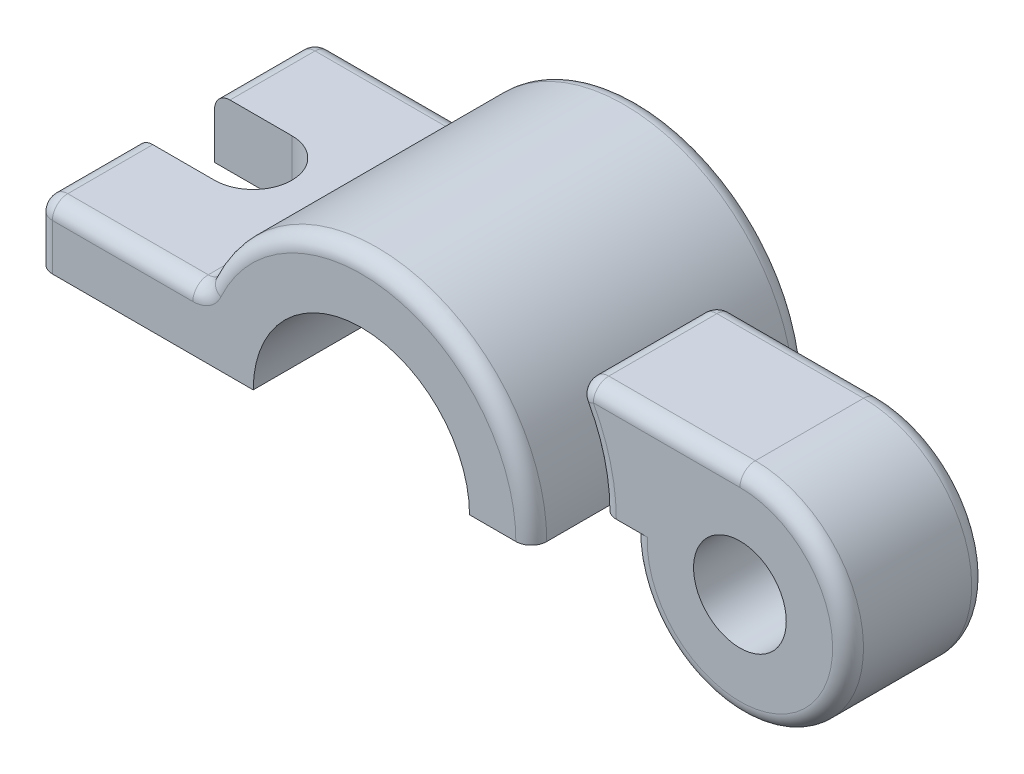
from build123d import *

# Parameters (mm, degrees)
EXTRUDE_1_DEPTH     = 18
SKETCH_4_R          = 6
EXTRUDE_4_DEPTH     = 36
CUT_EXTRUDE_START   = -28
SKETCH_7_W          = 36.681614088
SKETCH_7_H          = 9
CUT_EXTRUDE_5_DEPTH = 28
FILLET_1_R          = 2
CUT_EXTRUDE_6_DEPTH = 62.181883925
FILLET_2_R          = 2


with BuildPart() as part:
    # 草圖1 → 填料-伸長1 (new, symmetric)
    with BuildSketch(Plane.XY):
        with BuildLine():
            Line((14, 0), (22, 0))
            ThreePointArc((22, 0), (4.070268191, 21.620196966), (-20.493901532, 8))
            Line((-20.493901532, 8), (-42, 8))
            Line((-42, 8), (-42, 0))
            Line((-42, 0), (-14, 0))
            ThreePointArc((-14, 0), (0, 14), (14, 0))
        make_face()
    extrude(amount=EXTRUDE_1_DEPTH, both=True)

    # 圓角1
    fillet_1_edges = [part.edges().sort_by_distance(p)[0] for p in [
        (-20.493901532, 8, 0),
        (-42, 8, 0),
        (4.070268191, 21.620196966, 18),
        (-31.246950766, 8, 18),
        (4.070268191, 21.620196966, -18),
        (-42, 4, 18),
        (-42, 4, -18),
        (-31.246950766, 8, -18),
    ]]
    fillet(fillet_1_edges, radius=FILLET_1_R)

    # 草圖2 → 除料-伸長6 (cut, through all)
    with BuildSketch(Plane(origin=(0, 8, 0), x_dir=(1, 0, 0), z_dir=(0, 1, 0))):
        with BuildLine():
            Line((-42, -5), (-42, 5))
            Line((-42, 5), (-32, 5))
            ThreePointArc((-32, 5), (-27, 0), (-32, -5))
            Line((-32, -5), (-42, -5))
        make_face()
    extrude(amount=-CUT_EXTRUDE_6_DEPTH, mode=Mode.SUBTRACT)


with BuildPart() as body_2:
    # 草圖4 → 填料-伸長4 (new body)
    with BuildSketch(Plane.XY.offset(18)):
        with BuildLine():
            Line((40, 13.567369288), (17.318385912, 13.567369288))
            ThreePointArc((17.318385912, 13.567369288), (20.796688319, 7.176193627), (22, 0))
            Line((22, 0), (26.006686216, 0))
            ThreePointArc((26.006686216, 0), (49.745336578, -10.483919932), (40, 13.567369288))
        make_face()
        with Locations((40, -0.432630712)):
            Circle(SKETCH_4_R, mode=Mode.SUBTRACT)
    extrude(amount=-EXTRUDE_4_DEPTH)

    # 草圖7 → 除料-伸長5 (cut)
    with BuildSketch(Plane(origin=(0, 13.567369288, 0), x_dir=(1, 0, 0), z_dir=(0, 1, 0)).offset(CUT_EXTRUDE_START)):
        with Locations((35.659192956, 13.5)):
            Rectangle(SKETCH_7_W, SKETCH_7_H)
        with Locations((35.659192956, -13.5)):
            Rectangle(SKETCH_7_W, SKETCH_7_H)
    extrude(amount=CUT_EXTRUDE_5_DEPTH, mode=Mode.SUBTRACT)

    # 圓角2
    fillet_2_edges = [body_2.edges().sort_by_distance(p)[0] for p in [
        (17.318385912, 13.567369288, 0),
        (28.659192956, 13.567369288, -9),
        (20.796688319, 7.176193627, -9),
        (49.745336578, -10.483919932, -9),
        (28.659192956, 13.567369288, 9),
        (49.745336578, -10.483919932, 9),
        (20.796688319, 7.176193627, 9),
    ]]
    fillet(fillet_2_edges, radius=FILLET_2_R)


solid = Compound([part.part, body_2.part])
